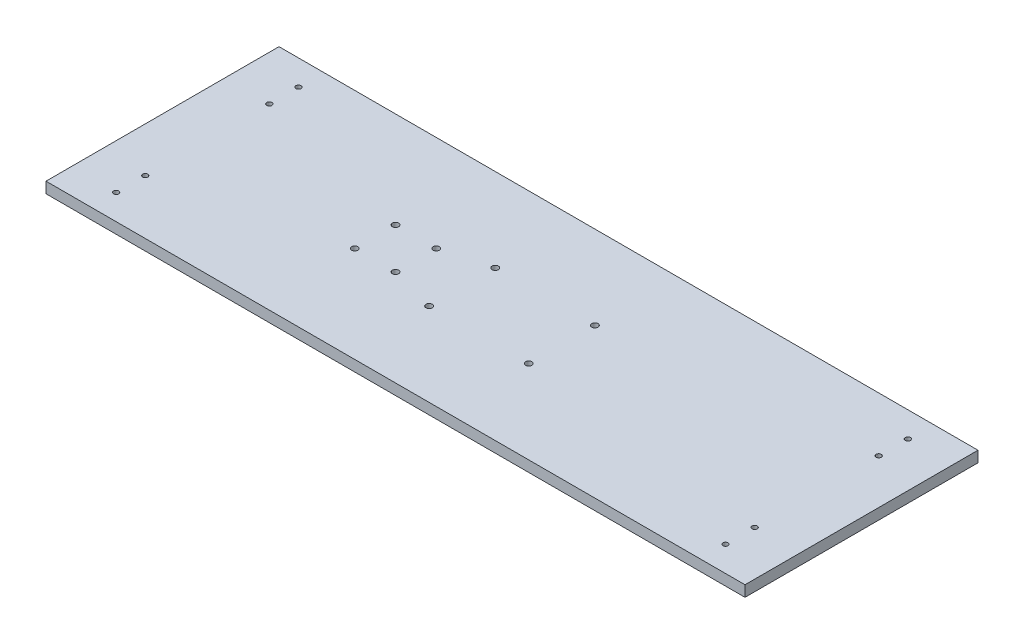
from build123d import *

# Parameters (mm, degrees)
SKETCH1_W                  = 609.6
SKETCH1_H                  = 203.2
TABLE_BLANK_DEPTH          = 9.525
TABLE_HOLES_M5_CLEARANCE_D = 5.5
RUNNER_HOLES_D             = 5.5
WHEEL_HOLES_M4_CLEARANCE_D = 4.5


with BuildPart() as part:
    # Sketch1 → Table Blank (new body)
    with BuildSketch(Plane(origin=(0, 0, 0), x_dir=(1, 0, 0), z_dir=(0, 1, 0))):
        with Locations((304.8, 101.6)):
            Rectangle(SKETCH1_W, SKETCH1_H)
    extrude(amount=TABLE_BLANK_DEPTH)

    # Table Holes (M5 Clearance) (through all)
    with Locations(Plane(origin=(0, 9.525, 0), x_dir=(1, 0, 0), z_dir=(0, 1, 0))):
        with Locations((261.366, 130.429), (348.234, 130.429), (348.234, 72.771), (261.366, 72.771)):
            Hole(TABLE_HOLES_M5_CLEARANCE_D / 2)

    # Runner Holes (through all)
    with Locations(Plane(origin=(0, 9.525, 0), x_dir=(1, 0, 0), z_dir=(0, 1, 0))):
        with Locations((185.42, 119.38), (220.98, 119.38), (220.98, 83.82), (185.42, 83.82)):
            Hole(RUNNER_HOLES_D / 2)

    # Wheel Holes (M4 Clearance) (through all)
    with Locations(Plane(origin=(0, 9.525, 0), x_dir=(1, 0, 0), z_dir=(0, 1, 0))):
        with Locations((39.0779, 181.102), (39.0779, 155.702), (39.0779, 47.498), (39.0779, 22.098)):
            wheel_holes_m4_clearance = Hole(WHEEL_HOLES_M4_CLEARANCE_D / 2)

    # Mirror1: Wheel Holes (M4 Clearance) across plane
    add(wheel_holes_m4_clearance.mirror(Plane.ZY.offset(-304.8)), mode=Mode.SUBTRACT)


solid = part.part
